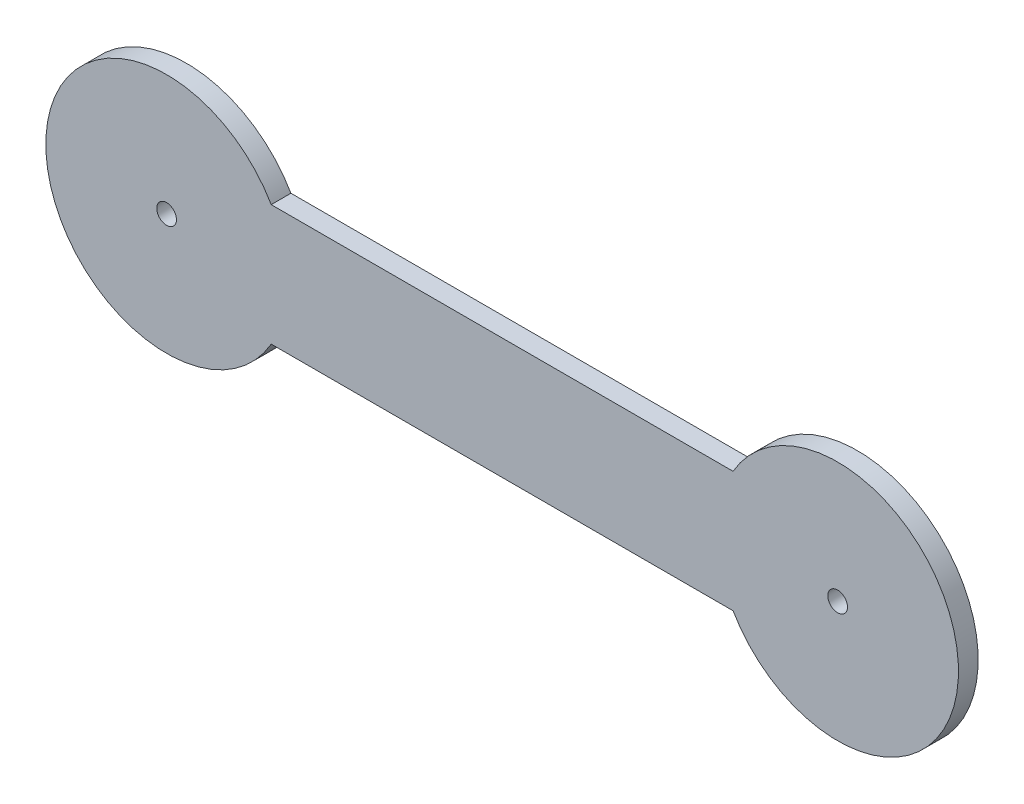
from build123d import *

# Parameters (mm, degrees)
BOSS_EXTRUDE1_DEPTH = 6.223


with BuildPart() as part:
    # Sketch1 → Boss-Extrude1 (new body)
    with BuildSketch(Plane.XY):
        with BuildLine():
            Line((0, 15.9385), (0, 0))
            Line((0, 0), (32.995567884, 0))
            ThreePointArc((32.995567884, 0), (36.801773982, 9.188994382), (38.1, 19.05))
            ThreePointArc((38.1, 19.05), (36.801773982, 28.911005618), (32.995567884, 38.1))
            Line((32.995567884, 38.1), (0, 38.1))
            Line((0, 38.1), (0, 22.1615))
            ThreePointArc((0, 22.1615), (2.20016275, 21.25016275), (3.1115, 19.05))
            ThreePointArc((3.1115, 19.05), (2.20016275, 16.84983725), (0, 15.9385))
        make_face()
        with BuildLine():
            Line((32.995567884, 0), (0, 0))
            Line((0, 0), (0, 15.9385))
            ThreePointArc((0, 15.9385), (-3.1115, 19.05), (0, 22.1615))
            Line((0, 22.1615), (0, 38.1))
            Line((0, 38.1), (32.995567884, 38.1))
            ThreePointArc((32.995567884, 38.1), (-38.1, 19.05), (32.995567884, 0))
        make_face()
        with BuildLine():
            ThreePointArc((38.1, 19.05), (36.801773982, 9.188994382), (32.995567884, 0))
            Line((32.995567884, 0), (178.671098782, 0))
            ThreePointArc((178.671098782, 0), (173.566666667, 19.05), (178.671098782, 38.1))
            Line((178.671098782, 38.1), (32.995567884, 38.1))
            ThreePointArc((32.995567884, 38.1), (36.801773982, 28.911005618), (38.1, 19.05))
        make_face()
        with BuildLine():
            ThreePointArc((178.671098782, 38.1), (173.566666667, 19.05), (178.671098782, 0))
            Line((178.671098782, 0), (211.666666667, 0))
            Line((211.666666667, 0), (211.666666667, 15.9385))
            ThreePointArc((211.666666667, 15.9385), (208.555166667, 19.05), (211.666666667, 22.1615))
            Line((211.666666667, 22.1615), (211.666666667, 38.1))
            Line((211.666666667, 38.1), (178.671098782, 38.1))
        make_face()
        with BuildLine():
            Line((211.666666667, 0), (178.671098782, 0))
            ThreePointArc((178.671098782, 0), (221.527672285, -17.751773982), (249.766666667, 19.05))
            ThreePointArc((249.766666667, 19.05), (221.527672285, 55.851773982), (178.671098782, 38.1))
            Line((178.671098782, 38.1), (211.666666667, 38.1))
            Line((211.666666667, 38.1), (211.666666667, 22.1615))
            ThreePointArc((211.666666667, 22.1615), (213.866829416, 21.25016275), (214.778166667, 19.05))
            ThreePointArc((214.778166667, 19.05), (213.866829416, 16.84983725), (211.666666667, 15.9385))
            Line((211.666666667, 15.9385), (211.666666667, 0))
        make_face()
    extrude(amount=BOSS_EXTRUDE1_DEPTH)


solid = part.part
